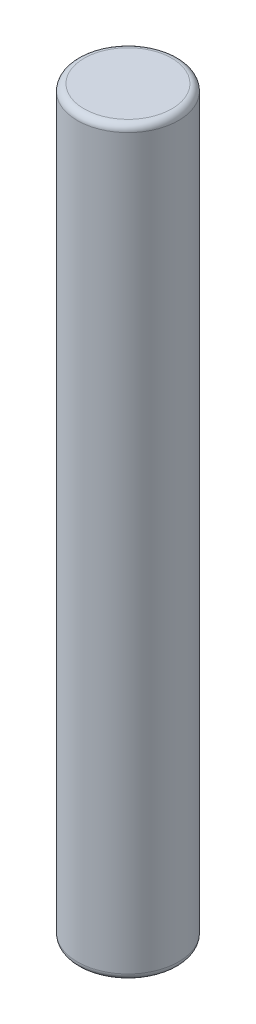
from build123d import *

# Parameters (mm, degrees)
SKETCH1_R           = 15
BOSS_EXTRUDE1_DEPTH = 110
FILLET1_R           = 2


with BuildPart() as part:
    # Sketch1 → Boss-Extrude1 (new, symmetric)
    with BuildSketch(Plane(origin=(0, 0, 0), x_dir=(1, 0, 0), z_dir=(0, 1, 0))):
        with Locations(Location((0, 0, 0), (0, 0, 270))):
            Circle(SKETCH1_R)
    extrude(amount=BOSS_EXTRUDE1_DEPTH, both=True)

    # Fillet1
    fillet1_edges = [part.edges().sort_by_distance(p)[0] for p in [
        (0, -110, -15),
        (0, 110, -15),
    ]]
    fillet(fillet1_edges, radius=FILLET1_R)


solid = part.part
